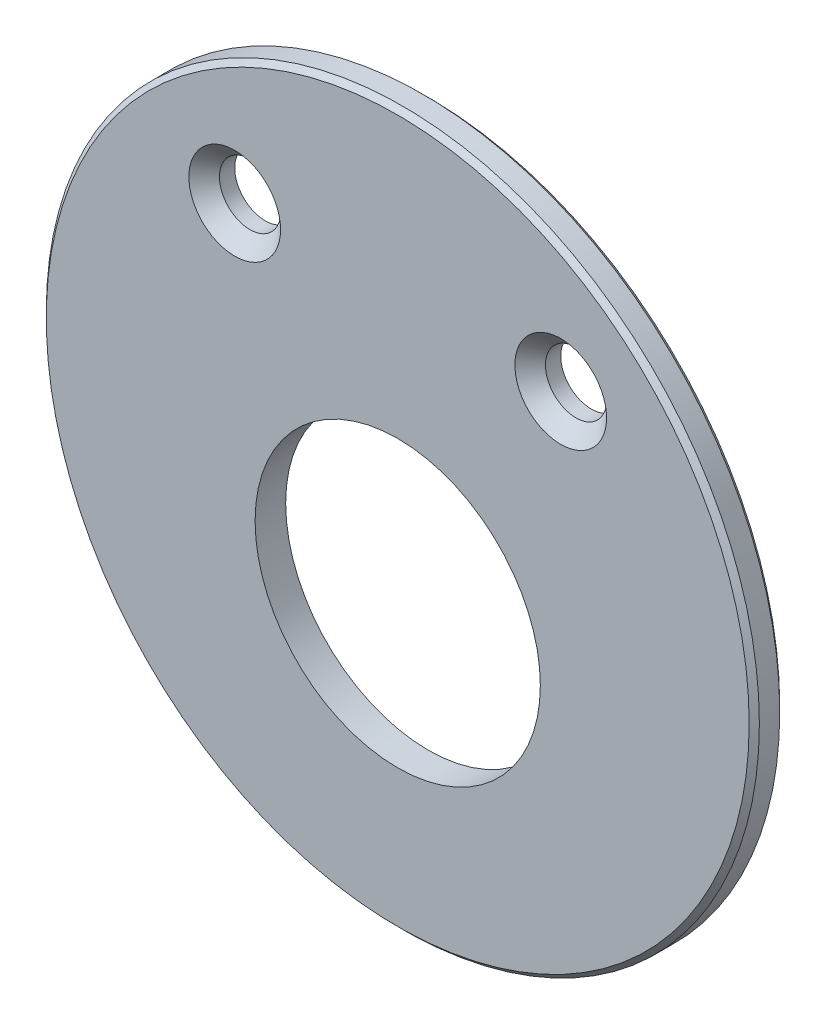
from build123d import *

# Parameters (mm, degrees)
SKETCH1_R           = 17.5
BOSS_EXTRUDE1_DEPTH = 1.5
SKETCH2_R           = 7
SKETCH2_R_2         = 1.5
CUT_EXTRUDE1_DEPTH  = 1.5
CHAMFER1_SIZE       = 0.75
CHAMFER2_SIZE       = 0.25


with BuildPart() as part:
    # Sketch1 → Boss-Extrude1 (new body)
    with BuildSketch(Plane.XY):
        Circle(SKETCH1_R)
    extrude(amount=BOSS_EXTRUDE1_DEPTH)

    # Sketch2 → Cut-Extrude1 (cut)
    with BuildSketch(Plane.XY.offset(1.5)):
        with Locations((0, -3.5)):
            Circle(SKETCH2_R)
        with Locations((-8, 9.5)):
            Circle(SKETCH2_R_2)
        with Locations((8, 9.5)):
            Circle(SKETCH2_R_2)
    extrude(amount=-CUT_EXTRUDE1_DEPTH, mode=Mode.SUBTRACT)

    # Chamfer1
    chamfer1_edges = [part.edges().sort_by_distance(p)[0] for p in [
        (-9.5, 9.5, 1.5),
        (6.5, 9.5, 1.5),
    ]]
    chamfer(chamfer1_edges, length=CHAMFER1_SIZE)

    # Chamfer2
    chamfer2_edges = [part.edges().sort_by_distance(p)[0] for p in [
        (-17.5, 0, 0),
        (-17.5, 0, 1.5),
    ]]
    chamfer(chamfer2_edges, length=CHAMFER2_SIZE)


solid = part.part
